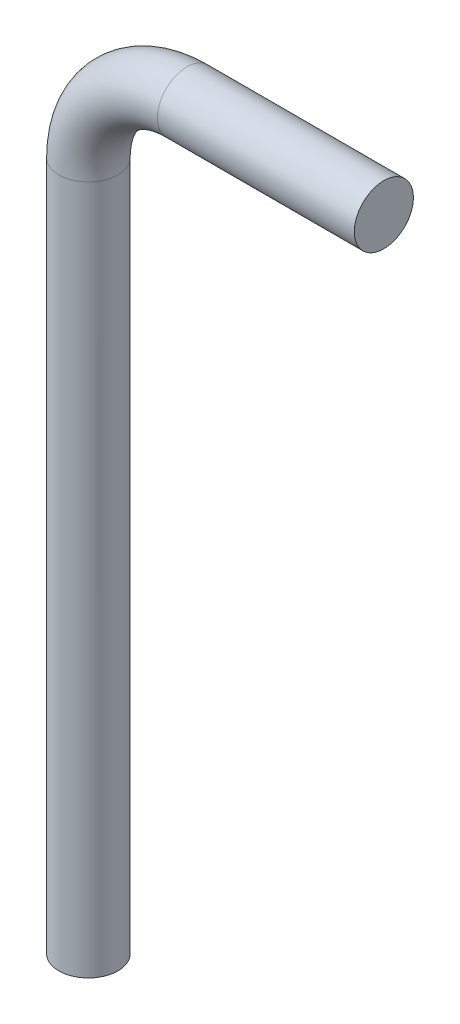
from build123d import *

# Parameters (mm, degrees)
SKETCH2_R = 3


with BuildPart() as part:
    # Sweep1: sweep along a path in Sketch1
    with BuildLine(Plane.XY) as sweep1_path:
        Line((0, 0), (0, 70))
        ThreePointArc((0, 70), (2.928932188, 77.071067812), (10, 80))
        Line((10, 80), (30, 80))
    # Sketch2 → Sweep1 (sweep)
    with BuildSketch(Plane(origin=(30, 80, 0), x_dir=(0, 0, -1), z_dir=(1, 0, 0))):
        Circle(SKETCH2_R)
    sweep(path=sweep1_path.line)


solid = part.part
